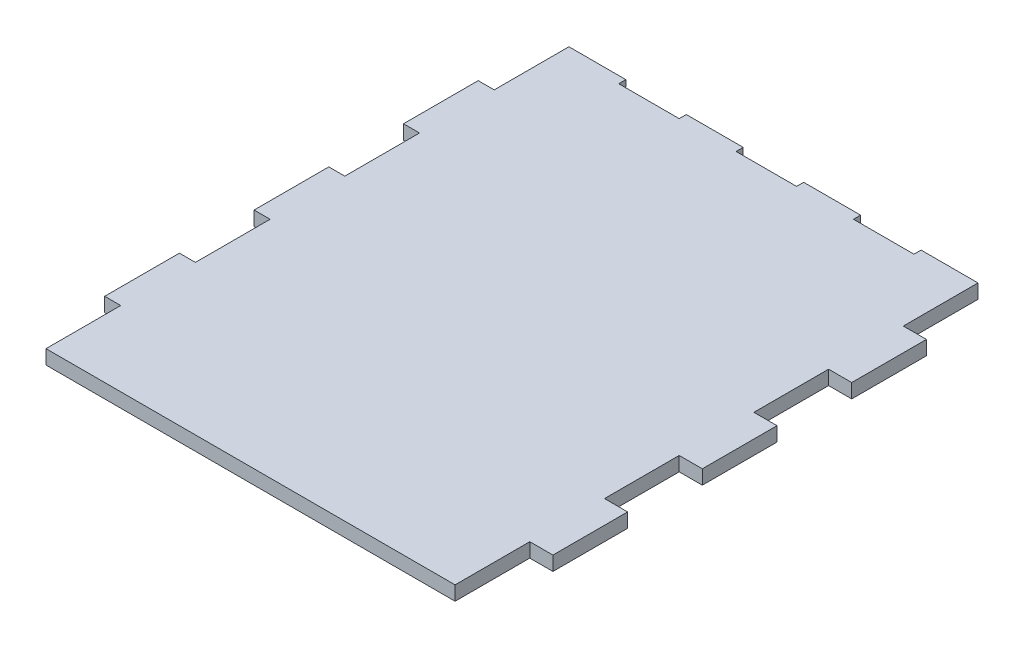
from build123d import *

# Parameters (mm, degrees)
SKETCH_4_W          = 115
SKETCH_4_H          = 145
EXTRUDE_1_DEPTH     = 4
SKETCH_5_W          = 16
SKETCH_5_H          = 4
EXTRUDE_2_DEPTH     = 2
SKETCH_6_W          = 21
SKETCH_6_H          = 4
EXTRUDE_3_DEPTH     = 4.5
EXTRUDE_START       = -115
SKETCH_6_2_W        = 21
SKETCH_6_2_H        = 4
EXTRUDE_4_DEPTH     = 6.5
CUT_EXTRUDE_START   = -1.8
SKETCH_7_W          = 20.6
SKETCH_7_H          = 2.2
CUT_EXTRUDE_1_DEPTH = 159.577679245
CUT_EXTRUDE_2_DEPTH = 99.239961319


with BuildPart() as part:
    # 草图4 → 凸台-拉伸1 (new body)
    with BuildSketch(Plane(origin=(0, 0, 0), x_dir=(1, 0, 0), z_dir=(0, 1, 0))):
        Rectangle(SKETCH_4_W, SKETCH_4_H)
    extrude(amount=EXTRUDE_1_DEPTH)

    # 草图5 → 凸台-拉伸2 (add)
    with BuildSketch(Plane(origin=(0, 0, -72.5), x_dir=(-1, 0, 0), z_dir=(0, 0, -1))):
        with Locations((-49.5, 2)):
            Rectangle(SKETCH_5_W, SKETCH_5_H)
        with Locations((-16.5, 2)):
            Rectangle(SKETCH_5_W, SKETCH_5_H)
        with Locations((16.5, 2)):
            Rectangle(SKETCH_5_W, SKETCH_5_H)
        with Locations((49.5, 2)):
            Rectangle(SKETCH_5_W, SKETCH_5_H)
    extrude(amount=EXTRUDE_2_DEPTH)

    # 草图6 → 凸台-拉伸3 (add)
    with BuildSketch(Plane.ZY.offset(57.5)):
        with Locations((-43, 2)):
            Rectangle(SKETCH_6_W, SKETCH_6_H)
        with Locations((-1, 2)):
            Rectangle(SKETCH_6_W, SKETCH_6_H)
        with Locations((41, 2)):
            Rectangle(SKETCH_6_W, SKETCH_6_H)
    extrude(amount=EXTRUDE_3_DEPTH)

    # 草图6<2> → 凸台-拉伸4 (add)
    with BuildSketch(Plane.ZY.offset(57.5).offset(EXTRUDE_START)):
        with Locations((-43, 2)):
            Rectangle(SKETCH_6_2_W, SKETCH_6_2_H)
        with Locations((-1, 2)):
            Rectangle(SKETCH_6_2_W, SKETCH_6_2_H)
        with Locations((41, 2)):
            Rectangle(SKETCH_6_2_W, SKETCH_6_2_H)
    extrude(amount=-EXTRUDE_4_DEPTH)

    # 草图7 → 切除-拉伸1 (cut, through all)
    with BuildSketch(Plane.XY.offset(72.5).offset(CUT_EXTRUDE_START)):
        with Locations((31.5, 1.1)):
            Rectangle(SKETCH_7_W, SKETCH_7_H)
        with Locations((-31.5, 1.1)):
            Rectangle(SKETCH_7_W, SKETCH_7_H)
        Polygon((-21.2, 2.2), (-19, 2.2), (-21.2, 0), align=None)
        Polygon((-41.8, 2.2), (-41.8, 0), (-44, 2.2), align=None)
        Polygon((41.8, 2.2), (44, 2.2), (41.8, 0), align=None)
        Polygon((21.2, 2.2), (21.2, 0), (19, 2.2), align=None)
    extrude(amount=-CUT_EXTRUDE_1_DEPTH, mode=Mode.SUBTRACT)

    # 草图8 → 切除-拉伸2 (cut, through all)
    with BuildSketch(Plane.XZ.offset(-2.2)):
        Polygon((-49.65, -74.5), (-41.8, -54.5), (41.8, -54.5), (49.65, -74.5), align=None)
    extrude(amount=CUT_EXTRUDE_2_DEPTH, mode=Mode.SUBTRACT)


solid = part.part
